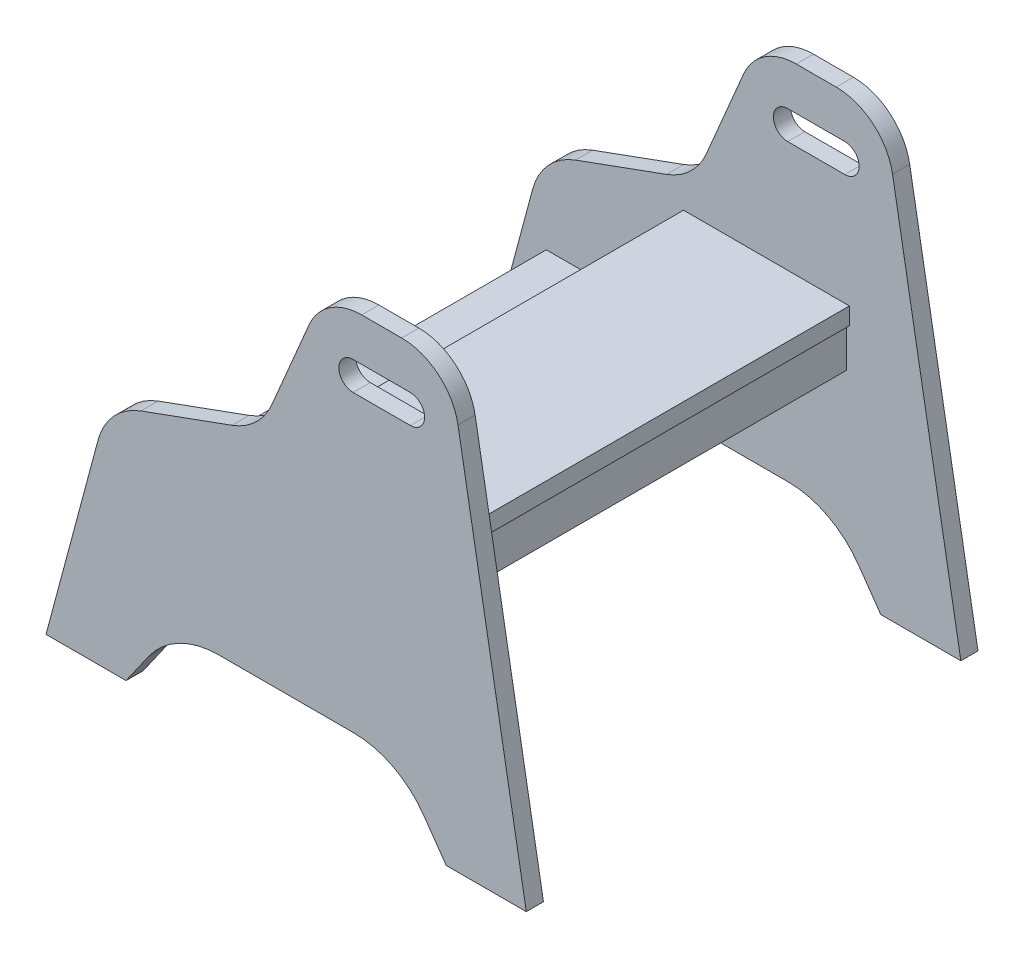
from build123d import *

# Parameters (mm, degrees)
BOSS_EXTRUDE1_DEPTH = 15
BOSS_EXTRUDE2_DEPTH = 365


with BuildPart() as part:
    # Sketch1 → Boss-Extrude1 (new body)
    with BuildSketch(Plane.XY):
        with BuildLine():
            Line((0, 0), (45.50587847, 169.830250493))
            ThreePointArc((45.50587847, 169.830250493), (59.224787839, 194.836520244), (82.940219448, 210.682665034))
            Line((82.940219448, 210.682665034), (162.723089982, 239.721255113))
            ThreePointArc((162.723089982, 239.721255113), (183.503155924, 252.5803501), (197.43217259, 272.658944651))
            Line((197.43217259, 272.658944651), (230.064782718, 349.536556424))
            ThreePointArc((230.064782718, 349.536556424), (248.493176125, 371.694291103), (276.090025391, 380))
            Line((276.090025391, 380), (311.040765772, 380))
            ThreePointArc((311.040765772, 380), (343.180146256, 368.302222156), (360.281153423, 338.682408883))
            Line((360.281153423, 338.682408883), (420, 0))
            Line((420, 0), (350, 0))
            Line((350, 0), (330.381422238, 28.018232726))
            ThreePointArc((330.381422238, 28.018232726), (303.576164909, 51.525812488), (268.945018916, 60))
            Line((268.945018916, 60), (151.054981084, 60))
            ThreePointArc((151.054981084, 60), (116.423835091, 51.525812488), (89.618577762, 28.018232726))
            Line((89.618577762, 28.018232726), (70, 0))
            Line((70, 0), (0, 0))
        make_face()
        with BuildLine():
            Line((268.565395581, 342.5), (318.565395581, 342.5))
            ThreePointArc((318.565395581, 342.5), (331.065395581, 330), (318.565395581, 317.5))
            Line((318.565395581, 317.5), (268.565395581, 317.5))
            ThreePointArc((268.565395581, 317.5), (256.065395581, 330), (268.565395581, 342.5))
        make_face(mode=Mode.SUBTRACT)
    boss_extrude1 = extrude(amount=BOSS_EXTRUDE1_DEPTH)

    # Sketch3 → Boss-Extrude2 (add)
    with BuildSketch(Plane.XY.offset(15)):
        Polygon((200, 115), (202.5, 115), (202.5, 130), (57.5, 130), (57.5, 115), (60, 115), (60, 80), (200, 80), align=None)
        Polygon((177.5, 220), (322.5, 220), (322.5, 205), (320, 205), (320, 170), (180, 170), (180, 205), (177.5, 205), align=None)
    extrude(amount=BOSS_EXTRUDE2_DEPTH)

    # Mirror1: Boss-Extrude1 across plane
    add(boss_extrude1.mirror(Plane.XY.offset(197.5)))


solid = part.part
